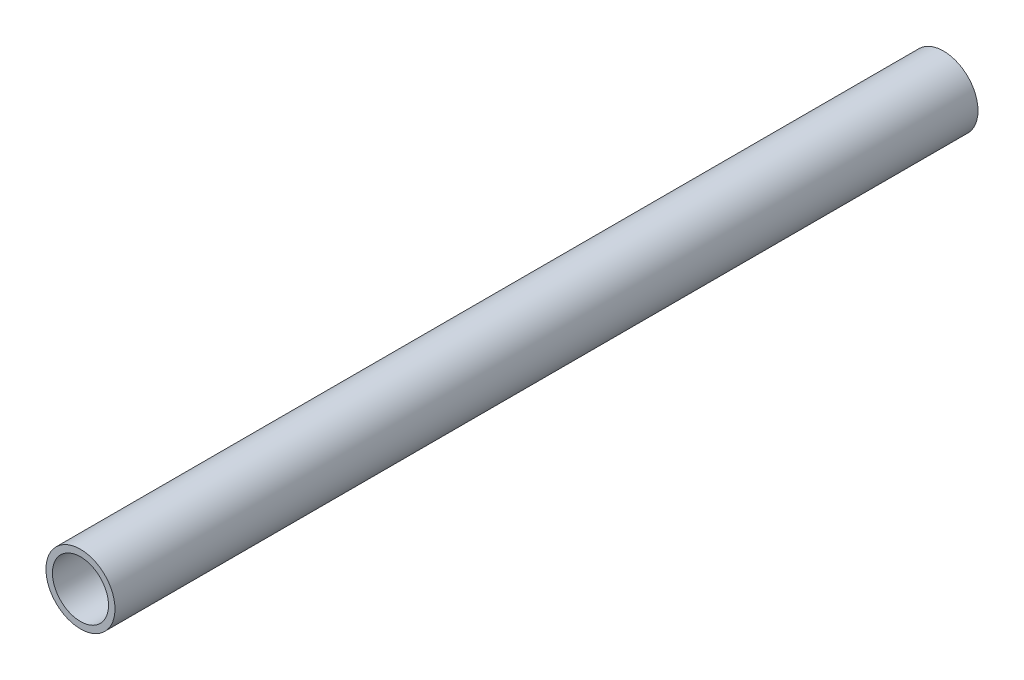
from build123d import *

# Parameters (mm, degrees)
CROQUIS1_R     = 16
EXTRUIR1_DEPTH = 200
VACIADO1_T     = -3


with BuildPart() as part:
    # Croquis1 → Extruir1 (new, symmetric)
    with BuildSketch(Plane.XY):
        Circle(CROQUIS1_R)
    extrude(amount=EXTRUIR1_DEPTH, both=True)

    # Vaciado1
    vaciado1_openings = [part.faces().sort_by_distance(p)[0] for p in [
        (0, 0, 200),
        (0, 0, -200),
    ]]
    offset(amount=VACIADO1_T, openings=vaciado1_openings, kind=Kind.INTERSECTION)


solid = part.part
